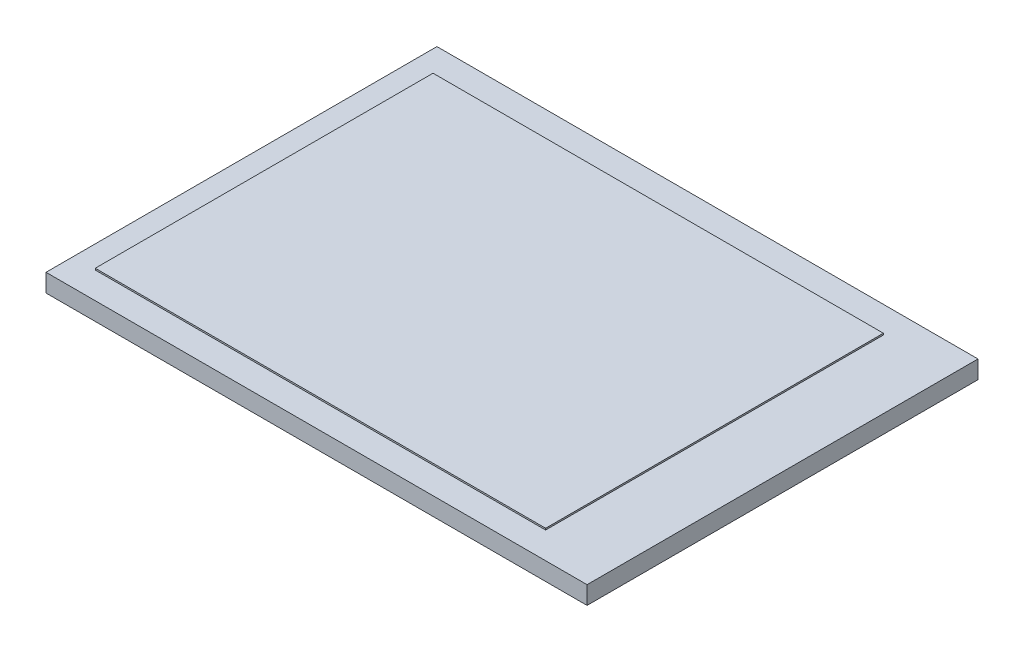
from build123d import *

# Parameters (mm, degrees)
SKETCH_1_W      = 69.2
SKETCH_1_H      = 50
EXTRUDE_1_DEPTH = 2.3
SKETCH_2_W      = 57.6
SKETCH_2_H      = 43.2
EXTRUDE_2_DEPTH = 0.2


with BuildPart() as part:
    # 草图1 → 凸台-拉伸1 (new body)
    with BuildSketch(Plane(origin=(0, 0, 0), x_dir=(1, 0, 0), z_dir=(0, 1, 0))):
        Rectangle(SKETCH_1_W, SKETCH_1_H)
    extrude(amount=EXTRUDE_1_DEPTH)

    # 草图2 → 凸台-拉伸2 (add)
    with BuildSketch(Plane(origin=(0, 2.3, 0), x_dir=(1, 0, 0), z_dir=(0, 1, 0))):
        with Locations((-2.9, 0)):
            Rectangle(SKETCH_2_W, SKETCH_2_H)
    extrude(amount=EXTRUDE_2_DEPTH)


solid = part.part
